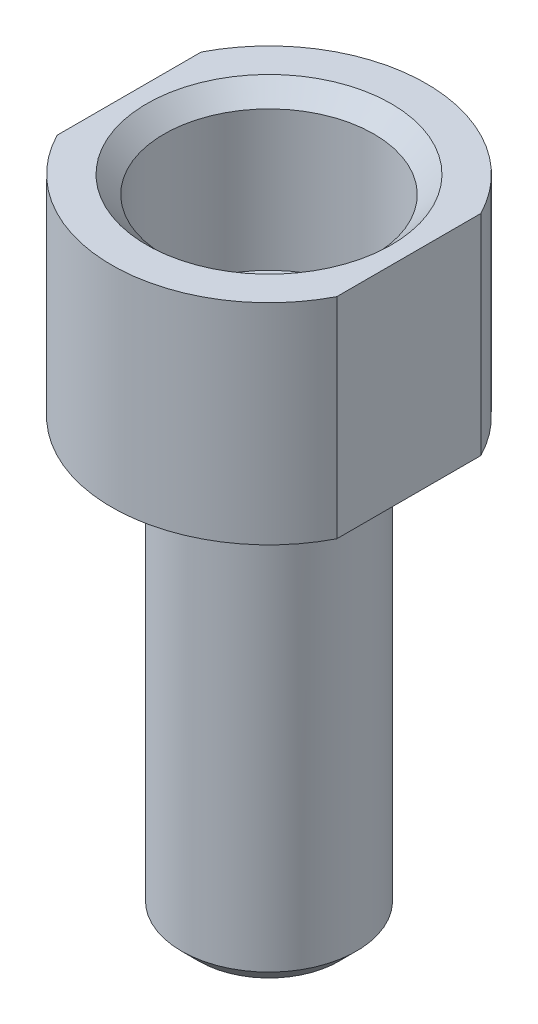
from build123d import *

# Parameters (mm, degrees)
ENL_V_MAT_EXTRU_1_DEPTH = 40.127995093
CHANFREIN1_SIZE         = 1
CHANFREIN2_SIZE         = 0.5
CHANFREIN3_SIZE         = 1


with BuildPart() as part:
    # Esquisse1 → Révolution1 (revolve)
    with BuildSketch(Plane.XY, mode=Mode.PRIVATE) as r_volution1_sk:
        Polygon((3.3, 6), (2.5, 6), (2.5, 22), (3.3, 22), (3.3, 28), (6, 28), (6, 37), (9, 37), (9, 25), (7.56, 25), (7.56, 26.25), (5.41, 26.25), (5.41, 25), (5, 25), (5, 0), (3.3, 0), align=None)
    revolve(r_volution1_sk.sketch.rotate(Axis((0, 0, 0), (0, 1, 0)), 90), axis=Axis((0, 0, 0), (0, 1, 0)))

    # Esquisse2 → Enlèv. mat.-Extru.1 (cut, through all)
    with BuildSketch(Plane(origin=(0, 37, 0), x_dir=(1, 0, 0), z_dir=(0, 1, 0))):
        with BuildLine():
            Line((-8, 4.123105626), (-8, -4.123105626))
            ThreePointArc((-8, -4.123105626), (-9, 0), (-8, 4.123105626))
        make_face()
        with BuildLine():
            Line((8, 4.123105626), (8, -4.123105626))
            ThreePointArc((8, -4.123105626), (9, 0), (8, 4.123105626))
        make_face()
    extrude(amount=-ENL_V_MAT_EXTRU_1_DEPTH, mode=Mode.SUBTRACT)

    # Chanfrein1
    chanfrein1_edges = [part.edges().sort_by_distance(p)[0] for p in [
        (0, 37, 6),
    ]]
    chamfer(chanfrein1_edges, length=CHANFREIN1_SIZE)

    # Chanfrein2
    chanfrein2_edges = [part.edges().sort_by_distance(p)[0] for p in [
        (0, 6, 2.5),
        (0, 22, 2.5),
        (0, 28, 3.3),
        (0, 0, 3.3),
    ]]
    chamfer(chanfrein2_edges, length=CHANFREIN2_SIZE)

    # Chanfrein3
    chanfrein3_edges = [part.edges().sort_by_distance(p)[0] for p in [
        (0, 0, 5),
    ]]
    chamfer(chanfrein3_edges, length=CHANFREIN3_SIZE)


solid = part.part
